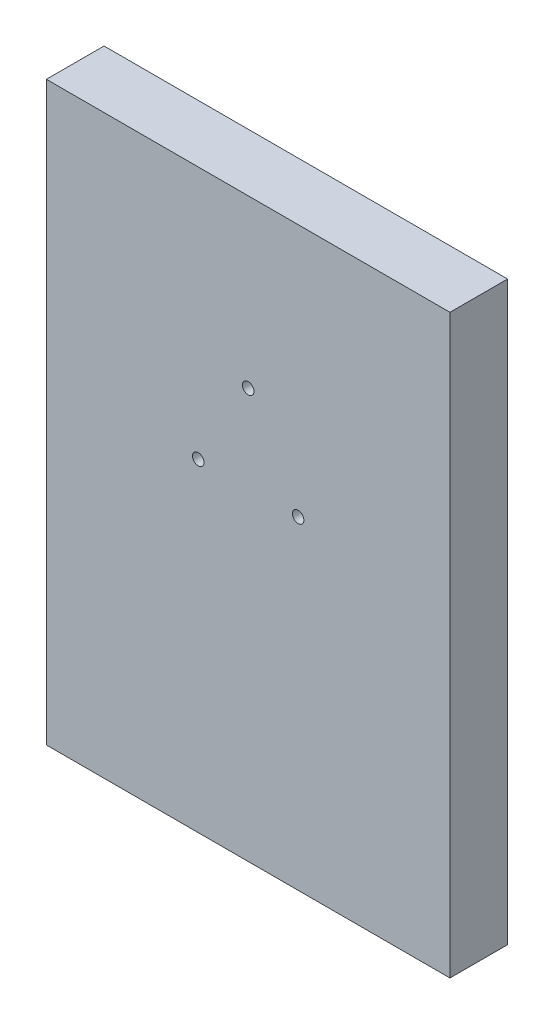
from build123d import *

# Parameters (mm, degrees)
SKETCH1_W           = 70
SKETCH1_H           = 100
BOSS_EXTRUDE1_DEPTH = 5
SKETCH2_R           = 1
CUT_EXTRUDE1_DEPTH  = 62.846584384


with BuildPart() as part:
    # Sketch1 → Boss-Extrude1 (new, symmetric)
    with BuildSketch(Plane.XY):
        Rectangle(SKETCH1_W, SKETCH1_H)
    extrude(amount=BOSS_EXTRUDE1_DEPTH, both=True)

    # Sketch2 → Cut-Extrude1 (cut, through all)
    with BuildSketch(Plane.XY.offset(5)):
        with Locations((0, 21.098295345)):
            Circle(SKETCH2_R)
        with Locations((8.660254038, 6.098295345)):
            Circle(SKETCH2_R)
        with Locations((-8.660254038, 6.098295345)):
            Circle(SKETCH2_R)
    extrude(amount=-CUT_EXTRUDE1_DEPTH, mode=Mode.SUBTRACT)


solid = part.part
